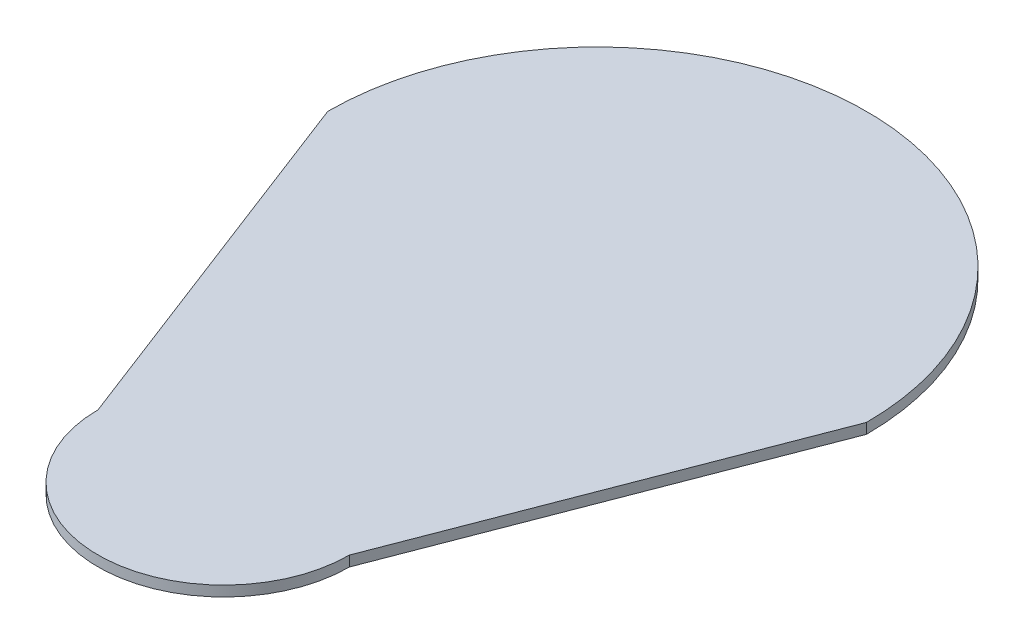
from build123d import *

# Parameters (mm, degrees)
SALIENTE_EXTRUIR1_DEPTH = 5


with BuildPart() as part:
    # Croquis1 → Saliente-Extruir1 (new body)
    with BuildSketch(Plane(origin=(0, 0, 0), x_dir=(1, 0, 0), z_dir=(0, 1, 0))):
        with BuildLine():
            Line((-130, 0), (-60.690182916, -180.17726832))
            ThreePointArc((-60.690182916, -180.17726832), (0, -240.867451236), (60.690182916, -180.17726832))
            Line((60.690182916, -180.17726832), (130, 0))
            ThreePointArc((130, 0), (0, 130), (-130, 0))
        make_face()
    extrude(amount=SALIENTE_EXTRUIR1_DEPTH)


solid = part.part
